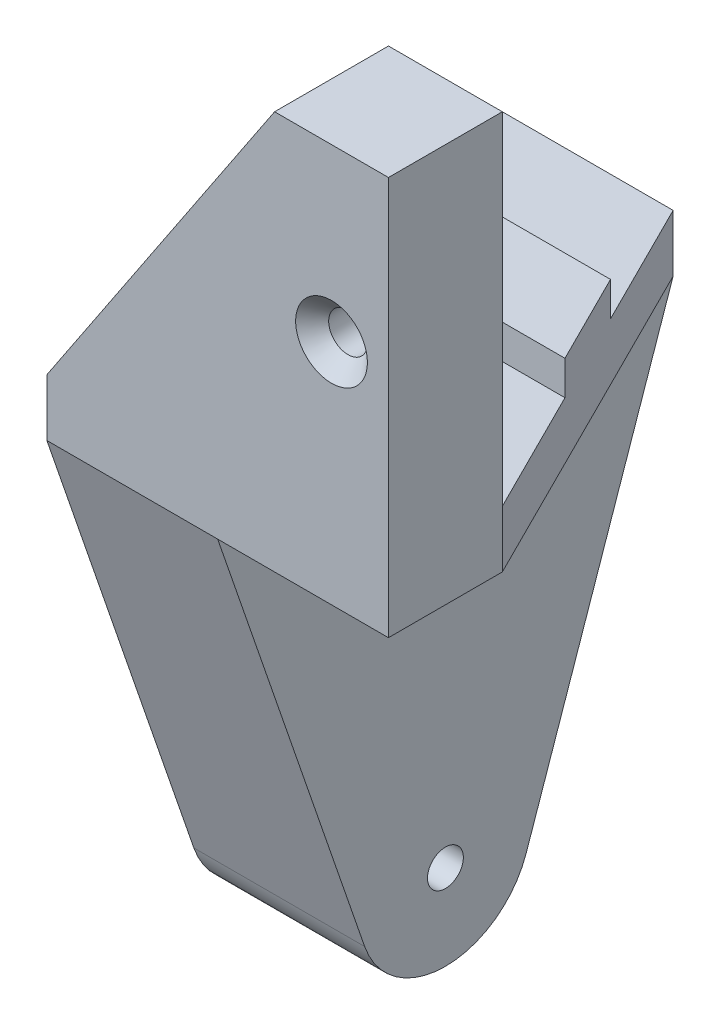
from build123d import *

# Parameters (mm, degrees)
EXTRUDE_1_DEPTH              = 10
EXTRUDE_2_DEPTH              = 5
EXTRUDE_3_DEPTH              = 15
EXTRUDE_4_DEPTH              = 3
HOLE_WIZARD_M3_1_D           = 3.4
HOLE_WIZARD_M3_1_CSINK_D     = 6.3
HOLE_WIZARD_M3_1_CSINK_ANGLE = 90
HOLE_WIZARD_M3_1_2_D         = 3.15


with BuildPart() as part:
    # 草图1 → 凸台-拉伸1 (new body)
    with BuildSketch(Plane.XY):
        Polygon((0, 0), (20, 30), (30, 30), (30, 0), align=None)
    extrude(amount=EXTRUDE_1_DEPTH)

    # 草图2 → 凸台-拉伸2 (add)
    with BuildSketch(Plane.XZ):
        Polygon((0, 10), (30, 10), (30, 0), (15, -30), (0, -30), align=None)
    extrude(amount=EXTRUDE_2_DEPTH)

    # 草图3 → 凸台-拉伸3 (add)
    with BuildSketch(Plane.ZY):
        with BuildLine():
            Line((-30, -5), (-17.090434036, -42.444533735))
            ThreePointArc((-17.090434036, -42.444533735), (-10, -47.5), (-2.909565964, -42.444533735))
            Line((-2.909565964, -42.444533735), (10, -5))
            Line((10, -5), (-30, -5))
        make_face()
    extrude(amount=-EXTRUDE_3_DEPTH)

    # 草图4 → 凸台-拉伸4 (add)
    with BuildSketch(Plane(origin=(0, 0, 0), x_dir=(1, 0, 0), z_dir=(0, 1, 0))):
        Polygon((0, 11), (24.5, 11), (20.5, 19), (0, 19), align=None)
    extrude(amount=EXTRUDE_4_DEPTH)

    # Hole Wizard M3 _1 (through all)
    with Locations(Plane.XY.offset(10)):
        with Locations((25, 15)):
            CounterSinkHole(HOLE_WIZARD_M3_1_D / 2, HOLE_WIZARD_M3_1_CSINK_D / 2, counter_sink_angle=HOLE_WIZARD_M3_1_CSINK_ANGLE)

    # Hole Wizard M3 _1 2 (through all)
    with Locations(Plane.ZY):
        with Locations((-10, -40)):
            Hole(HOLE_WIZARD_M3_1_2_D / 2)


solid = part.part
